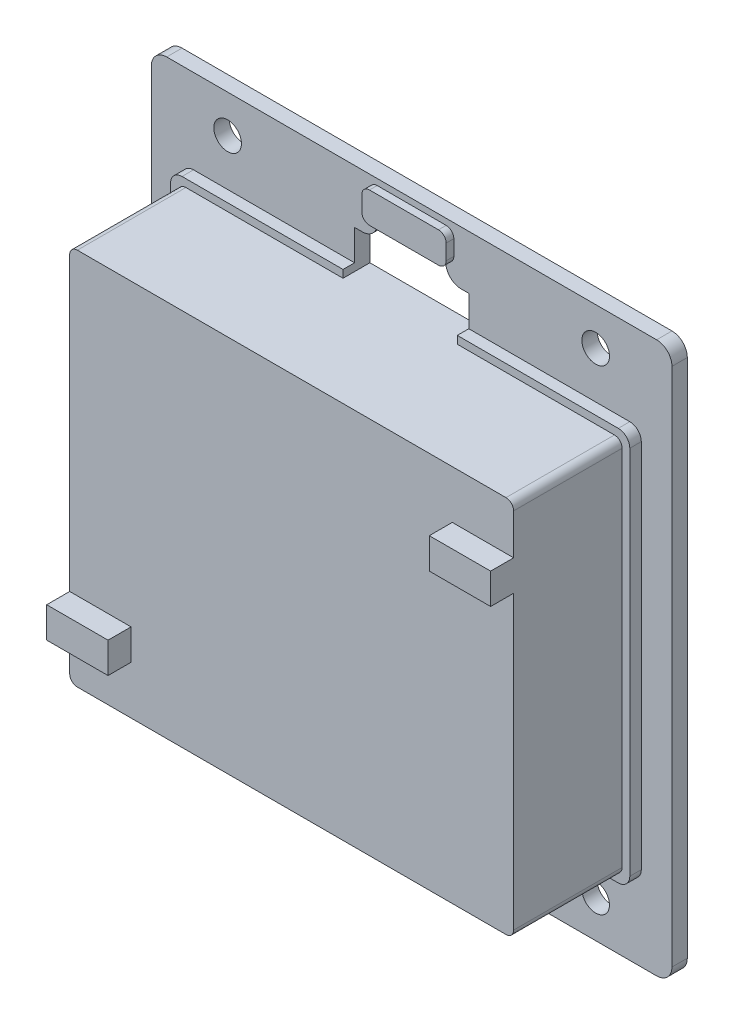
from build123d import *

# Parameters (mm, degrees)
SKETCH_1_W          = 67.9
SKETCH_1_H          = 71.85
EXTRUDE_1_DEPTH     = 2
SKETCH_2_W          = 59.9
SKETCH_2_H          = 51.35
EXTRUDE_2_DEPTH     = 1.5
SKETCH_3_W          = 57.9
SKETCH_3_H          = 49.35
EXTRUDE_3_DEPTH     = 14.15
SKETCH_4_R          = 1.8
CUT_EXTRUDE_1_DEPTH = 53.485527767
FILLET_1_R          = 2
FILLET_2_R          = 1.5
FILLET_3_R          = 1
CUT_EXTRUDE_2_DEPTH = 53.485527767
FILLET_4_R          = 2
SKETCH_7_W          = 11
SKETCH_7_H          = 4
EXTRUDE_4_DEPTH     = 1
FILLET_5_R          = 1
SKETCH_8_W          = 8
SKETCH_8_H          = 4
EXTRUDE_5_DEPTH     = 3


with BuildPart() as part:
    # 草图1 → 凸台-拉伸1 (new body)
    with BuildSketch(Plane.XY):
        Rectangle(SKETCH_1_W, SKETCH_1_H)
    extrude(amount=EXTRUDE_1_DEPTH)

    # 草图2 → 凸台-拉伸2 (add)
    with BuildSketch(Plane.XY.offset(2)):
        with Locations((0, -0.75)):
            Rectangle(SKETCH_2_W, SKETCH_2_H)
    extrude(amount=EXTRUDE_2_DEPTH)

    # 草图3 → 凸台-拉伸3 (add)
    with BuildSketch(Plane.XY.offset(3.5)):
        with Locations((0, -0.75)):
            Rectangle(SKETCH_3_W, SKETCH_3_H)
    extrude(amount=EXTRUDE_3_DEPTH)

    # 草图4 → 切除-拉伸1 (cut, through all)
    with BuildSketch(Plane(origin=(0, 0, 0), x_dir=(-1, 0, 0), z_dir=(0, 0, -1))):
        with Locations((24, 31)):
            Circle(SKETCH_4_R)
        with Locations((-24, 31)):
            Circle(SKETCH_4_R)
        with Locations((-24, -31)):
            Circle(SKETCH_4_R)
        with Locations((24, -31)):
            Circle(SKETCH_4_R)
    extrude(amount=-CUT_EXTRUDE_1_DEPTH, mode=Mode.SUBTRACT)

    # 圆角1
    fillet_1_edges = [part.edges().sort_by_distance(p)[0] for p in [
        (33.95, -35.925, 1),
        (-33.95, -35.925, 1),
        (-33.95, 35.925, 1),
        (33.95, 35.925, 1),
    ]]
    fillet(fillet_1_edges, radius=FILLET_1_R)

    # 圆角2
    fillet_2_edges = [part.edges().sort_by_distance(p)[0] for p in [
        (-29.95, 24.925, 2.75),
        (-29.95, -26.425, 2.75),
        (29.95, -26.425, 2.75),
        (29.95, 24.925, 2.75),
    ]]
    fillet(fillet_2_edges, radius=FILLET_2_R)

    # 圆角3
    fillet_3_edges = [part.edges().sort_by_distance(p)[0] for p in [
        (-28.95, 23.925, 10.575),
        (-28.95, -25.425, 10.575),
        (28.95, -25.425, 10.575),
        (28.95, 23.925, 10.575),
    ]]
    fillet(fillet_3_edges, radius=FILLET_3_R)

    # 草图6 → 切除-拉伸2 (cut, through all)
    with BuildSketch(Plane(origin=(0, 0, 0), x_dir=(-1, 0, 0), z_dir=(0, 0, -1))):
        Polygon((-4.45, 33.925), (4.45, 33.925), (4.45, 28.925), (7.45, 28.925), (7.45, 23.925), (-7.45, 23.925), (-7.45, 28.925), (-4.45, 28.925), align=None)
    extrude(amount=-CUT_EXTRUDE_2_DEPTH, mode=Mode.SUBTRACT)

    # 圆角4
    fillet_4_edges = [part.edges().sort_by_distance(p)[0] for p in [
        (4.45, 28.925, 1),
        (-4.45, 28.925, 1),
    ]]
    fillet(fillet_4_edges, radius=FILLET_4_R)

    # 草图7 → 凸台-拉伸4 (add)
    with BuildSketch(Plane.XY.offset(2)):
        with Locations((0, 33.125)):
            Rectangle(SKETCH_7_W, SKETCH_7_H)
    extrude(amount=EXTRUDE_4_DEPTH)

    # 圆角5
    fillet_5_edges = [part.edges().sort_by_distance(p)[0] for p in [
        (-5.5, 35.125, 2.5),
        (-5.5, 31.125, 2.5),
        (5.5, 31.125, 2.5),
        (5.5, 35.125, 2.5),
    ]]
    fillet(fillet_5_edges, radius=FILLET_5_R)

    # 草图8 → 凸台-拉伸5 (add)
    with BuildSketch(Plane.XY.offset(17.65)):
        with Locations((24.95, 15.625)):
            Rectangle(SKETCH_8_W, SKETCH_8_H)
        with Locations((-24.95, -17.125)):
            Rectangle(SKETCH_8_W, SKETCH_8_H)
    extrude(amount=EXTRUDE_5_DEPTH)


solid = part.part
